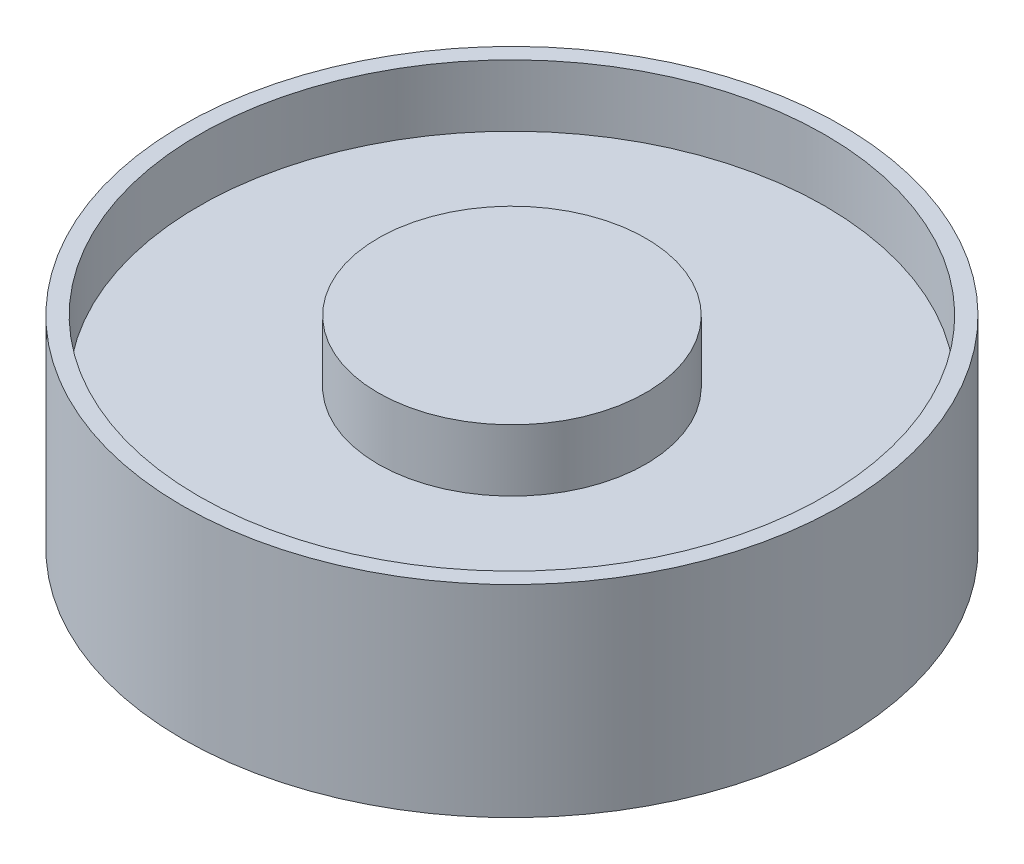
from build123d import *

# Parameters (mm, degrees)
SKETCH1_R           = 8
BOSS_EXTRUDE1_DEPTH = 3.4
SKETCH2_R           = 8
SKETCH2_R_2         = 7.6
SKETCH2_R_3         = 3.25
BOSS_EXTRUDE2_DEPTH = 1.5


with BuildPart() as part:
    # Sketch1 → Boss-Extrude1 (new body)
    with BuildSketch(Plane(origin=(0, 0, 0), x_dir=(1, 0, 0), z_dir=(0, 1, 0))):
        with Locations(Location((0, 0, 0), (0, 0, 270))):
            Circle(SKETCH1_R)
    extrude(amount=BOSS_EXTRUDE1_DEPTH)

    # Sketch2 → Boss-Extrude2 (add)
    # profile 1 of 2: a face of its own
    with BuildSketch(Plane(origin=(0, 3.4, 0), x_dir=(1, 0, 0), z_dir=(0, 1, 0))):
        with Locations(Location((0, 0, 0), (0, 0, 270))):
            Circle(SKETCH2_R)
        with Locations(Location((0, 0, 0), (0, 0, 270))):
            Circle(SKETCH2_R_2, mode=Mode.SUBTRACT)
    # profile 2 of 2: a face of its own
    with BuildSketch(Plane(origin=(0, 3.4, 0), x_dir=(1, 0, 0), z_dir=(0, 1, 0))):
        with Locations(Location((0, 0, 0), (0, 0, 270))):
            Circle(SKETCH2_R_3)
    extrude(amount=BOSS_EXTRUDE2_DEPTH)


solid = part.part
